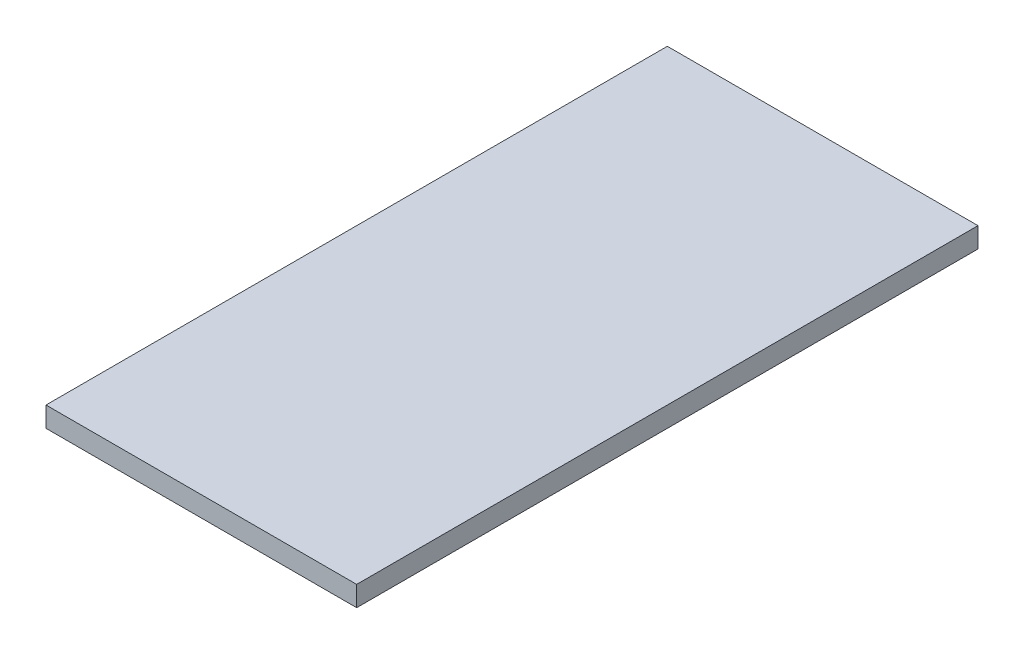
from build123d import *

# Parameters (mm, degrees)
SKETCH1_W           = 304.8
SKETCH1_H           = 609.6
BOSS_EXTRUDE1_DEPTH = 19.84375


with BuildPart() as part:
    # Sketch1 → Boss-Extrude1 (new body)
    with BuildSketch(Plane(origin=(0, 0, 0), x_dir=(1, 0, 0), z_dir=(0, 1, 0))):
        with Locations((152.4, 304.8)):
            Rectangle(SKETCH1_W, SKETCH1_H)
    extrude(amount=BOSS_EXTRUDE1_DEPTH)


solid = part.part
